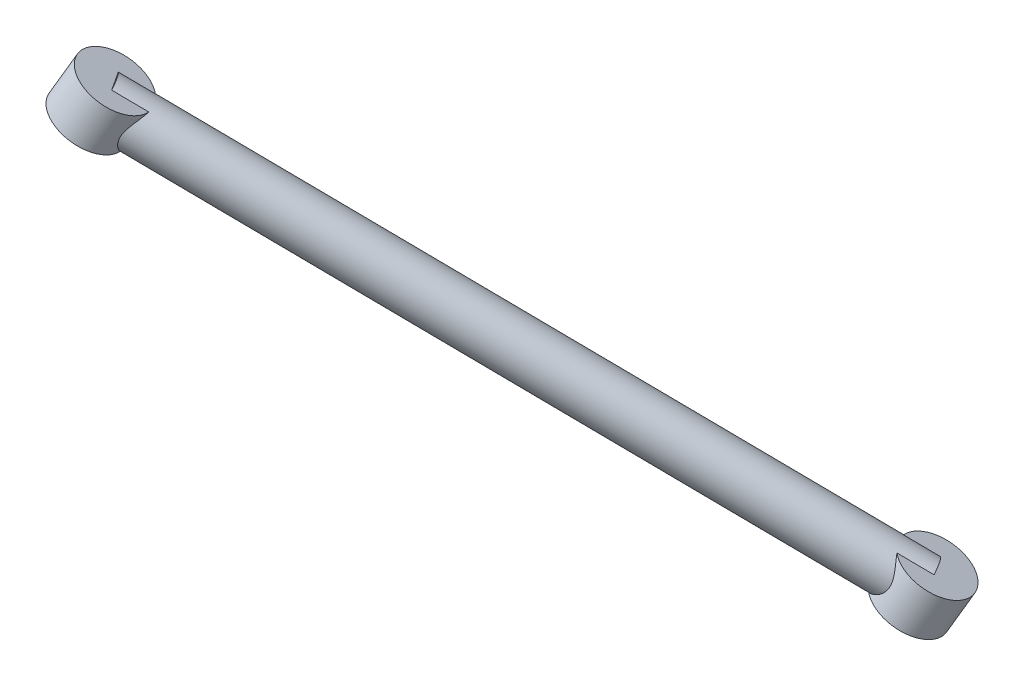
from build123d import *

# Parameters (mm, degrees)
SUSP_FR_PULLROD_PROFILE_R                = 8
SUSP_FR_PULLROD_ROD_END_MOUNT_PROFILE_R  = 11
SUSP_FR_PULLROD_ROD_END_ROCKER_PROFILE_R = 11


with BuildPart() as part:
    # SUSP_FR_pullrod: sweep along a curve in space
    with BuildLine() as susp_fr_pullrod_path:
        Line((510.46, -91.34, -282.35), (343.0563, 19.7951, -174.0819))
    # SUSP_FR_pullrod profile (on start of the path) → SUSP_FR_pullrod (sweep)
    with BuildSketch(Plane(origin=(510.46, -91.34, -282.35), x_dir=(-0.5530888804852541, -0.8331222541041432, 0), z_dir=(-0.73343010732889, 0.48690577520692124, 0.47434485739141324))):
        Circle(SUSP_FR_PULLROD_PROFILE_R)
    sweep(path=susp_fr_pullrod_path.line)

    # SUSP_FR_pullrod_rod_end_mount: sweep along a curve in space
    with BuildLine() as susp_fr_pullrod_rod_end_mount_path:
        Line((507.659168, -97.4533881, -280.405308), (513.260832, -85.2266119, -284.294692))
    # SUSP_FR_pullrod_rod_end_mount profile (on start of the path) → SUSP_FR_pullrod_rod_end_mount (sweep)
    with BuildSketch(Plane(origin=(507.659168, -97.4533881, -280.405308), x_dir=(0.9091288863966713, -0.4165149071991883, 0), z_dir=(0.4001188533527077, 0.8733411488700952, -0.27781314022554215))):
        Circle(SUSP_FR_PULLROD_ROD_END_MOUNT_PROFILE_R)
    sweep(path=susp_fr_pullrod_rod_end_mount_path.line)

    # SUSP_FR_pullrod_rod_end_rocker: sweep along a curve in space
    with BuildLine() as susp_fr_pullrod_rod_end_rocker_path:
        Line((340.255468, 13.6817119, -172.137208), (345.857132, 25.9084881, -176.026592))
    # SUSP_FR_pullrod_rod_end_rocker profile (on start of the path) → SUSP_FR_pullrod_rod_end_rocker (sweep)
    with BuildSketch(Plane(origin=(340.255468, 13.6817119, -172.137208), x_dir=(0.9091288863966681, -0.41651490719919537, 0), z_dir=(0.40011885335271413, 0.8733411488700913, -0.2778131402255451))):
        Circle(SUSP_FR_PULLROD_ROD_END_ROCKER_PROFILE_R)
    sweep(path=susp_fr_pullrod_rod_end_rocker_path.line)


solid = part.part
